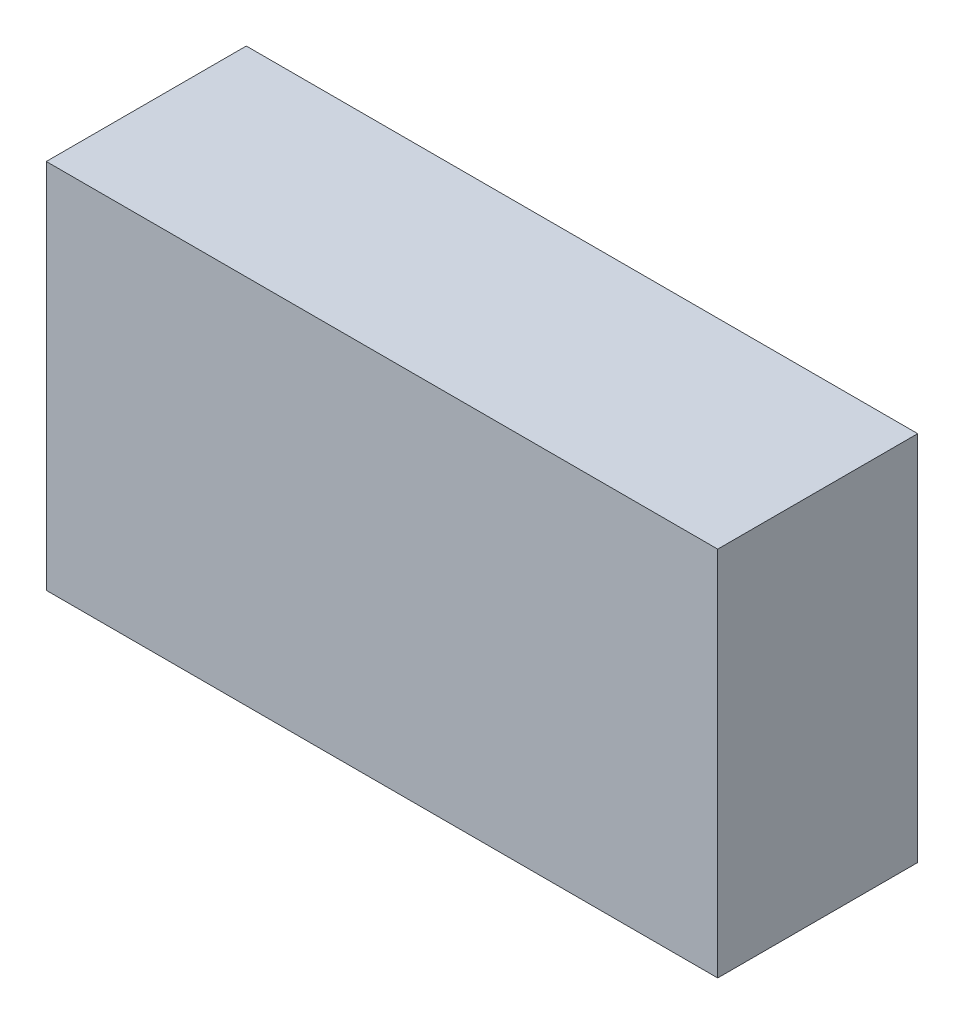
from build123d import *

# Parameters (mm, degrees)
SKETCH1_W           = 47
SKETCH1_H           = 26
BOSS_EXTRUDE1_DEPTH = 14
BOSS_EXTRUDE2_DEPTH = 0.5


with BuildPart() as part:
    # Sketch1 → Boss-Extrude1 (new body)
    with BuildSketch(Plane.XY):
        Rectangle(SKETCH1_W, SKETCH1_H)
    extrude(amount=BOSS_EXTRUDE1_DEPTH)

    # Sketch2 → Boss-Extrude2 (add)
    # profile 1 of 10: a face of its own
    with BuildSketch(Plane(origin=(0, 0, 0), x_dir=(-1, 0, 0), z_dir=(0, 0, -1))):
        Polygon((0.325641026, 3.175), (2.279487179, 3.175), (0.610576923, -0.081410256), (0.364438101, 0.054061498), (1.797385817, 2.849358974), (0.325641026, 2.849358974), align=None)
    # profile 2 of 10: a face of its own
    with BuildSketch(Plane(origin=(0, 0, 0), x_dir=(-1, 0, 0), z_dir=(0, 0, -1))):
        with BuildLine():
            add(Edge.make_bspline(
                [(3.073237179, 0.488461538), (3.090917586, 0.487410916), (3.125577957, 0.485351293), (3.175687737, 0.471221025), (3.221040036, 0.446130668), (3.261437144, 0.412690862), (3.294735162, 0.372145511), (3.320719681, 0.327154936), (3.33472686, 0.276625635), (3.33677148, 0.241764429), (3.337820513, 0.223878205)],
                knots=[0, 0, 0, 0, 1.020151414, 1.999887582, 2.974338812, 3.990962822, 5.007586832, 5.987933904, 6.967670073, 8, 8, 8, 8], degree=3))
            add(Edge.make_bspline(
                [(3.337820513, 0.223878205), (3.336735932, 0.206421756), (3.334597155, 0.171997895), (3.320751789, 0.121849711), (3.294537129, 0.076831019), (3.261666814, 0.035735508), (3.221030049, 0.002224861), (3.175580517, -0.02265203), (3.12569559, -0.037794041), (3.090937211, -0.039722896), (3.073237179, -0.040705128)],
                knots=[0, 0, 0, 0, 1.009421747, 1.99056486, 2.972319754, 3.999869655, 5.017953583, 5.993804169, 6.978383603, 8, 8, 8, 8], degree=3))
            add(Edge.make_bspline(
                [(3.073237179, -0.040705128), (3.055524394, -0.039758436), (3.020944396, -0.037910246), (2.971245673, -0.022341129), (2.925519351, 0.001991581), (2.884890498, 0.035797992), (2.851744885, 0.076619551), (2.826684716, 0.122159752), (2.811635081, 0.171854341), (2.809655811, 0.206393482), (2.808653846, 0.223878205)],
                knots=[0, 0, 0, 0, 1.022052826, 1.995314843, 2.982371812, 4.00089066, 5.028879526, 6.005146991, 6.990147033, 8, 8, 8, 8], degree=3))
            add(Edge.make_bspline(
                [(2.808653846, 0.223878205), (2.809617322, 0.241793714), (2.81149839, 0.276771546), (2.82671631, 0.326845022), (2.851550446, 0.372354963), (2.885119625, 0.412629004), (2.925509522, 0.4463632), (2.971135366, 0.470914834), (3.021064091, 0.485465779), (3.055544536, 0.487445633), (3.073237179, 0.488461538)],
                knots=[0, 0, 0, 0, 1.032775665, 2.016367738, 2.991239715, 4.008302682, 5.025365648, 6.011011707, 6.979408107, 8, 8, 8, 8], degree=3))
        make_face()
    # profile 3 of 10: a face of its own
    with BuildSketch(Plane(origin=(0, 0, 0), x_dir=(-1, 0, 0), z_dir=(0, 0, -1))):
        Polygon((5.478019832, 3.256410256), (5.535897436, 3.256410256), (5.535897436, 1.058333333), (5.90224359, 1.058333333), (5.90224359, 0.732692308), (5.535897436, 0.732692308), (5.535897436, 0), (5.250961538, 0), (5.250961538, 0.732692308), (3.744871795, 0.732692308), align=None)
        Polygon((5.250961538, 1.058333333), (5.250961538, 2.437219551), (4.304567308, 1.058333333), align=None, mode=Mode.SUBTRACT)
    # profile 4 of 10: a face of its own
    with BuildSketch(Plane(origin=(0, 0, 0), x_dir=(-1, 0, 0), z_dir=(0, 0, -1))):
        Polygon((6.227884615, 3.175), (6.533173077, 3.175), (7.59150641, 0.672906651), (8.649839744, 3.175), (8.955128205, 3.175), (7.611858974, 0), (7.571153846, 0), align=None)
    # profile 5 of 10: a face of its own
    with BuildSketch(Plane(origin=(0, 0, 0), x_dir=(-1, 0, 0), z_dir=(0, 0, -1))):
        Polygon((1.855263421, -3.03525641), (1.913141026, -3.03525641), (1.913141026, -5.233333333), (2.279487179, -5.233333333), (2.279487179, -5.558974359), (1.913141026, -5.558974359), (1.913141026, -6.291666667), (1.628205128, -6.291666667), (1.628205128, -5.558974359), (0.122115385, -5.558974359), align=None)
        Polygon((1.628205128, -5.233333333), (1.628205128, -3.854447115), (0.681810897, -5.233333333), align=None, mode=Mode.SUBTRACT)
    # profile 6 of 10: a face of its own
    with BuildSketch(Plane(origin=(0, 0, 0), x_dir=(-1, 0, 0), z_dir=(0, 0, -1))):
        with BuildLine():
            Line((4.558974359, -3.116666667), (4.558974359, -3.442307692))
            Line((4.558974359, -3.442307692), (3.479016426, -3.442307692))
            Line((3.479016426, -3.442307692), (3.307927684, -4.277398838))
            add(Edge.make_bspline(
                [(3.307927684, -4.277398838), (3.341542656, -4.26811852), (3.406666347, -4.250139372), (3.502787078, -4.230176994), (3.594038577, -4.218143342), (3.653252663, -4.216500224), (3.68190605, -4.215705128)],
                knots=[0, 0, 0, 0, 1.100273476, 2.13160584, 3.095893838, 4, 4, 4, 4], degree=3))
            add(Edge.make_bspline(
                [(3.68190605, -4.215705128), (3.717360585, -4.216472513), (3.78707306, -4.217981382), (3.889071247, -4.232470132), (3.986437515, -4.255275626), (4.078968236, -4.287134956), (4.166834593, -4.3278745), (4.249228167, -4.37876516), (4.327385702, -4.438213253), (4.399905055, -4.506561943), (4.465694963, -4.581783695), (4.523539825, -4.662662621), (4.572673032, -4.748412714), (4.61218886, -4.839853266), (4.64374322, -4.935973356), (4.664745387, -5.037784341), (4.678730544, -5.144326564), (4.680292995, -5.217174282), (4.681089744, -5.254321915)],
                knots=[0, 0, 0, 0, 1.052922333, 2.070308379, 3.05430497, 4.020497103, 4.973039431, 5.925935799, 6.892292201, 7.88610001, 8.88166317, 9.857072816, 10.836096531, 11.812156883, 12.81219415, 13.836441305, 14.89672472, 16, 16, 16, 16], degree=3))
            add(Edge.make_bspline(
                [(4.681089744, -5.254321915), (4.680486425, -5.280195644), (4.679287942, -5.331593439), (4.673193223, -5.40792425), (4.661458681, -5.482639106), (4.645703674, -5.555747918), (4.625254481, -5.627112277), (4.60049941, -5.696936449), (4.570204442, -5.764785842), (4.536974552, -5.831302451), (4.499558104, -5.894982525), (4.458030458, -5.954535534), (4.414156048, -6.010854847), (4.366947077, -6.063336448), (4.315964746, -6.111635471), (4.26182649, -6.156038555), (4.204964309, -6.197296619), (4.144498482, -6.23373491), (4.081776373, -6.267265592), (4.015892204, -6.294773372), (3.948345712, -6.319366494), (3.878164718, -6.338969423), (3.805508188, -6.354329668), (3.730256356, -6.364762356), (3.652803891, -6.372360982), (3.600302986, -6.372836648), (3.573783053, -6.373076923)],
                knots=[0, 0, 0, 0, 1.056347294, 2.098418968, 3.122841568, 4.141288669, 5.149314143, 6.15115421, 7.162517403, 8.180376062, 9.185164535, 10.17417709, 11.141909838, 12.097768115, 13.052685741, 14.0056014, 14.954263652, 15.917497458, 16.885230207, 17.854509472, 18.828990115, 19.81800267, 20.826176721, 21.857883937, 22.917946725, 24, 24, 24, 24], degree=3))
            add(Edge.make_bspline(
                [(3.573783053, -6.373076923), (3.542147189, -6.372450234), (3.479907364, -6.371217298), (3.38872085, -6.358319101), (3.300986886, -6.33984612), (3.217411723, -6.312054646), (3.137246362, -6.277231886), (3.061570039, -6.233220788), (2.988449085, -6.183346886), (2.920856024, -6.124491138), (2.858121549, -6.060160483), (2.801963502, -5.990348909), (2.751949471, -5.916208629), (2.708880372, -5.837379589), (2.672142882, -5.754068922), (2.643282142, -5.665964485), (2.619988206, -5.573526625), (2.610133532, -5.509887369), (2.605128205, -5.477564103)],
                knots=[0, 0, 0, 0, 1.0467383, 2.05933395, 3.04377827, 4.011590433, 4.970194871, 5.932262533, 6.905835911, 7.896367577, 8.894135286, 9.877477877, 10.858688626, 11.851381753, 12.8477658, 13.868841284, 14.917554742, 16, 16, 16, 16], degree=3))
            Line((2.605128205, -5.477564103), (2.890064103, -5.477564103))
            add(Edge.make_bspline(
                [(2.890064103, -5.477564103), (2.897075008, -5.507841313), (2.910550358, -5.566035793), (2.94012843, -5.647797795), (2.976292474, -5.720658805), (3.01929499, -5.785582641), (3.070593947, -5.842196518), (3.129131357, -5.892649138), (3.194761078, -5.938165148), (3.267689221, -5.976104373), (3.344626801, -6.008461028), (3.425151341, -6.030007208), (3.507070284, -6.045157304), (3.562477091, -6.04667383), (3.590319511, -6.047435897)],
                knots=[0, 0, 0, 0, 1.136247022, 2.183929868, 3.172523383, 4.106158343, 5.02341133, 5.958108904, 6.928429099, 7.938127109, 8.96079061, 9.975095812, 10.982467395, 12, 12, 12, 12], degree=3))
            add(Edge.make_bspline(
                [(3.590319511, -6.047435897), (3.6174961, -6.046691335), (3.671007026, -6.045225284), (3.749757355, -6.033941323), (3.825787605, -6.016562669), (3.898347565, -5.990555015), (3.968706961, -5.958945878), (4.035086025, -5.918382916), (4.099405063, -5.871701328), (4.15966487, -5.818219242), (4.214854942, -5.759282448), (4.263619423, -5.696256527), (4.30423848, -5.629021959), (4.338468708, -5.558742741), (4.364461343, -5.484648622), (4.383004233, -5.407086841), (4.393892722, -5.325865824), (4.395390578, -5.270467235), (4.396153846, -5.24223758)],
                knots=[0, 0, 0, 0, 1.027316725, 2.022795036, 3.002884548, 3.971462791, 4.93288096, 5.914575861, 6.907176829, 7.935150275, 8.956128384, 9.956726525, 10.942570165, 11.921478529, 12.907843606, 13.90538589, 14.932640048, 16, 16, 16, 16], degree=3))
            add(Edge.make_bspline(
                [(4.396153846, -5.24223758), (4.395556511, -5.216768863), (4.394387313, -5.166917472), (4.384834581, -5.093983906), (4.368218471, -5.024974789), (4.34515538, -4.959556877), (4.315873255, -4.897668468), (4.280089814, -4.839245692), (4.237133518, -4.785058572), (4.188064447, -4.735081756), (4.134308939, -4.688958191), (4.074942115, -4.649638912), (4.011206324, -4.61656093), (3.943869473, -4.58801496), (3.871329887, -4.567512855), (3.795024085, -4.552120559), (3.714128071, -4.543216623), (3.658818947, -4.541981196), (3.630388622, -4.541346154)],
                knots=[0, 0, 0, 0, 1.045622112, 2.046656509, 3.013763289, 3.955457236, 4.890082067, 5.820317437, 6.762574623, 7.722996705, 8.69280354, 9.665887285, 10.63943826, 11.638615906, 12.663482002, 13.728887084, 14.832589034, 16, 16, 16, 16], degree=3))
            add(Edge.make_bspline(
                [(3.630388622, -4.541346154), (3.605778808, -4.541872833), (3.554965785, -4.542960292), (3.477021507, -4.550967185), (3.395114015, -4.56388426), (3.309557294, -4.581651784), (3.220094405, -4.604902832), (3.126914141, -4.632765272), (3.029820585, -4.666077371), (2.964399507, -4.691234451), (2.930769231, -4.704166667)],
                knots=[0, 0, 0, 0, 0.817624296, 1.688186739, 2.600797293, 3.572016777, 4.590301741, 5.671205678, 6.80286297, 8, 8, 8, 8], degree=3))
            Line((2.930769231, -4.704166667), (3.256410256, -3.116666667))
            Line((3.256410256, -3.116666667), (4.558974359, -3.116666667))
        make_face()
    # profile 7 of 10: a face of its own
    with BuildSketch(Plane(origin=(0, 0, 0), x_dir=(-1, 0, 0), z_dir=(0, 0, -1))):
        with BuildLine():
            add(Edge.make_bspline(
                [(5.006730769, -4.705438702), (5.007028329, -4.654550357), (5.007606342, -4.555699014), (5.014036552, -4.411658661), (5.02471847, -4.276530398), (5.039357372, -4.15030776), (5.057171826, -4.032958159), (5.080953017, -3.924795201), (5.107997488, -3.825318272), (5.139341493, -3.734202985), (5.174708987, -3.650221783), (5.213202924, -3.571821779), (5.256350987, -3.499121598), (5.301687187, -3.430960888), (5.351046709, -3.368455393), (5.403024897, -3.310722407), (5.459650456, -3.259096226), (5.518998471, -3.212064223), (5.581606264, -3.170835059), (5.645689254, -3.134519647), (5.711688528, -3.103495481), (5.77978428, -3.079102014), (5.849364458, -3.058953603), (5.920672297, -3.045175058), (5.993825534, -3.036505577), (6.043202621, -3.03567675), (6.068244191, -3.03525641)],
                knots=[0, 0, 0, 0, 1.646270934, 3.197905019, 4.663502075, 6.030701355, 7.308322542, 8.50163776, 9.611534131, 10.641858119, 11.616356847, 12.558055219, 13.465016945, 14.349605745, 15.204443733, 16.039544428, 16.859896111, 17.680448484, 18.487036065, 19.28249412, 20.06191084, 20.843045899, 21.620316918, 22.403196591, 23.190181807, 24, 24, 24, 24], degree=3))
            add(Edge.make_bspline(
                [(6.068244191, -3.03525641), (6.093494946, -3.035698928), (6.143710754, -3.036578957), (6.217951666, -3.045037105), (6.290477449, -3.059071624), (6.360978903, -3.07895708), (6.430035141, -3.103627444), (6.497106025, -3.134549328), (6.562608163, -3.170543729), (6.625500638, -3.212838247), (6.686473897, -3.259993597), (6.744030263, -3.313299732), (6.798174977, -3.372218406), (6.849587575, -3.43611924), (6.896809438, -3.506227853), (6.941779623, -3.581324867), (6.982031399, -3.66272358), (7.020797854, -3.749065861), (7.054259621, -3.842740752), (7.084436857, -3.943220213), (7.108819922, -4.051691083), (7.12913019, -4.167584248), (7.144864489, -4.291325322), (7.1563241, -4.422649051), (7.162377541, -4.561641834), (7.163517549, -4.656672169), (7.164102564, -4.705438702)],
                knots=[0, 0, 0, 0, 0.810914788, 1.612654377, 2.396697861, 3.181598691, 3.963628158, 4.749916497, 5.551656086, 6.361998678, 7.18212741, 8.025565596, 8.878627764, 9.750805457, 10.657531673, 11.591944965, 12.560506719, 13.57287815, 14.630710178, 15.753379473, 16.941251878, 18.199788006, 19.531962791, 20.947069417, 22.433333509, 24, 24, 24, 24], degree=3))
            add(Edge.make_bspline(
                [(7.164102564, -4.705438702), (7.163511484, -4.753992533), (7.162359788, -4.848597692), (7.156391961, -4.986965077), (7.144636631, -5.117591873), (7.129931856, -5.240791364), (7.109565626, -5.356050775), (7.084523796, -5.463768954), (7.056719575, -5.564411076), (7.022398012, -5.657152655), (6.984832582, -5.743287432), (6.943961082, -5.823721202), (6.900173454, -5.899164911), (6.85246795, -5.969014681), (6.801619496, -6.03376532), (6.746539788, -6.092273878), (6.688781472, -6.14595013), (6.62762878, -6.193712678), (6.563755444, -6.235518179), (6.498478282, -6.272905029), (6.43063907, -6.303051831), (6.361775177, -6.32893719), (6.290901587, -6.348713314), (6.218106647, -6.362387454), (6.143760633, -6.371977631), (6.093503499, -6.372709224), (6.068244191, -6.373076923)],
                knots=[0, 0, 0, 0, 1.561518951, 3.042555995, 4.452378317, 5.7783523, 7.031515105, 8.214008947, 9.334062868, 10.386615937, 11.391082383, 12.354592575, 13.286541444, 14.194233754, 15.072674879, 15.931287219, 16.775624067, 17.606195743, 18.42308326, 19.229000347, 20.022332153, 20.807536673, 21.593273796, 22.3848459, 23.188221202, 24, 24, 24, 24], degree=3))
            add(Edge.make_bspline(
                [(6.068244191, -6.373076923), (6.043203316, -6.372653872), (5.993827598, -6.371819698), (5.920664327, -6.363189384), (5.849650967, -6.349314178), (5.780437098, -6.329886259), (5.712667616, -6.306105657), (5.647265985, -6.275123387), (5.583505014, -6.239441767), (5.521554817, -6.198805921), (5.4625795, -6.152249822), (5.406247193, -6.100756503), (5.353973069, -6.04304098), (5.305319282, -5.980014579), (5.259078502, -5.912257137), (5.216543142, -5.838843542), (5.177199582, -5.760064888), (5.141237272, -5.675412212), (5.109352413, -5.583650242), (5.081187707, -5.483729201), (5.058949864, -5.37476716), (5.039915326, -5.257639262), (5.024562492, -5.131842197), (5.014081069, -4.99730767), (5.007602876, -4.854119516), (5.007026776, -4.755903363), (5.006730769, -4.705438702)],
                knots=[0, 0, 0, 0, 0.810891512, 1.598919785, 2.382837074, 3.152667961, 3.926044502, 4.706494248, 5.493654104, 6.291793342, 7.103789334, 7.925228297, 8.761435821, 9.622817696, 10.50288917, 11.416980706, 12.369136599, 13.353924996, 14.394355917, 15.514179734, 16.714354668, 17.994756427, 19.357759367, 20.818452758, 22.365282078, 24, 24, 24, 24], degree=3))
        make_face()
        with BuildLine():
            add(Edge.make_bspline(
                [(5.291666667, -4.704166667), (5.291775022, -4.746574415), (5.291985319, -4.828879527), (5.297479158, -4.948480199), (5.304963297, -5.060031855), (5.314616474, -5.163676134), (5.328952006, -5.259062217), (5.345014592, -5.346846144), (5.364561787, -5.426563352), (5.387689411, -5.498760866), (5.41403202, -5.564663949), (5.442793768, -5.625987909), (5.473691709, -5.683457165), (5.508271225, -5.73655551), (5.545931318, -5.785456102), (5.585821346, -5.831024457), (5.629430047, -5.871661719), (5.689758442, -5.920399651), (5.769402387, -5.970763437), (5.869750942, -6.014620247), (5.972864466, -6.042181475), (6.042851671, -6.045686454), (6.077784455, -6.047435897)],
                knots=[0, 0, 0, 0, 1.459021318, 2.831673884, 4.118529203, 5.306027144, 6.411944654, 7.436330062, 8.375795394, 9.233974572, 10.042671642, 10.816086306, 11.563610507, 12.285937304, 12.993564865, 13.685989202, 14.367179055, 15.041617293, 16.353048772, 17.594441528, 18.799311195, 20, 20, 20, 20], degree=3))
            add(Edge.make_bspline(
                [(6.077784455, -6.047435897), (6.1129432, -6.045986482), (6.1831881, -6.043090644), (6.285816615, -6.015151789), (6.38544836, -5.972997278), (6.463527905, -5.923152041), (6.522929927, -5.875682771), (6.56549034, -5.835210911), (6.604553769, -5.789893803), (6.641603366, -5.740999442), (6.675584099, -5.687593688), (6.706484231, -5.629933352), (6.734681267, -5.567858312), (6.750745902, -5.524524335), (6.758959335, -5.50236879)],
                knots=[0, 0, 0, 0, 1.353760809, 2.704726607, 4.075137775, 5.516104923, 6.260822281, 7.007110065, 7.778089737, 8.566572457, 9.372053459, 10.217411131, 11.088608312, 12, 12, 12, 12], degree=3))
            add(Edge.make_bspline(
                [(6.758959335, -5.50236879), (6.768531296, -5.474038955), (6.787966481, -5.41651724), (6.813014305, -5.327287356), (6.832740488, -5.233667706), (6.850487256, -5.136217778), (6.862600385, -5.034218907), (6.872350187, -4.927986687), (6.878093025, -4.817441023), (6.878804906, -4.742334138), (6.879166667, -4.704166667)],
                knots=[0, 0, 0, 0, 0.884706709, 1.796334032, 2.740027952, 3.714592787, 4.726048262, 5.777819803, 6.87074269, 8, 8, 8, 8], degree=3))
            add(Edge.make_bspline(
                [(6.879166667, -4.704166667), (6.878667566, -4.666005369), (6.87769122, -4.591353712), (6.873959245, -4.482026505), (6.864322145, -4.378187894), (6.853618659, -4.279390536), (6.837836894, -4.186181333), (6.820820884, -4.097779985), (6.797959784, -4.015281669), (6.773539702, -3.937394763), (6.745590272, -3.865004169), (6.714823856, -3.797772378), (6.681965546, -3.735374806), (6.646276514, -3.677982652), (6.60818043, -3.625338845), (6.566671796, -3.578498891), (6.523397115, -3.53601107), (6.462784382, -3.487512882), (6.383432705, -3.438062987), (6.284694153, -3.392555477), (6.181941498, -3.36642224), (6.112478436, -3.362737709), (6.077784455, -3.360897436)],
                knots=[0, 0, 0, 0, 1.31362396, 2.569729283, 3.763502607, 4.902122613, 5.988968491, 7.01645872, 7.998833611, 8.933434873, 9.825090667, 10.667526885, 11.477055099, 12.250526234, 12.991942729, 13.710640831, 14.402115721, 15.076753259, 16.378508321, 17.609869233, 18.806226677, 20, 20, 20, 20], degree=3))
            add(Edge.make_bspline(
                [(6.077784455, -3.360897436), (6.042668418, -3.362740248), (5.972372371, -3.36642923), (5.868551726, -3.39245811), (5.769034207, -3.437827015), (5.689892366, -3.487676667), (5.62923736, -3.535154992), (5.586526631, -3.57632699), (5.546479746, -3.621363235), (5.509588332, -3.670713544), (5.475035911, -3.723749984), (5.443303135, -3.780889792), (5.414712415, -3.842422529), (5.388328585, -3.90829601), (5.365130413, -3.980487295), (5.345995175, -4.060106311), (5.328317634, -4.147611027), (5.315803355, -4.243513724), (5.304678376, -4.347183963), (5.297528868, -4.459014101), (5.291966941, -4.578815361), (5.291768763, -4.661546026), (5.291666667, -4.704166667)],
                knots=[0, 0, 0, 0, 1.207732386, 2.417664972, 3.655092373, 4.956220595, 5.625982001, 6.301752483, 6.994047911, 7.697131622, 8.419323945, 9.170223765, 9.943494443, 10.752040957, 11.610060368, 12.549350801, 13.567764191, 14.679664412, 15.874934091, 17.154273443, 18.533957287, 20, 20, 20, 20], degree=3))
        make_face(mode=Mode.SUBTRACT)
    # profile 8 of 10: a face of its own
    with BuildSketch(Plane(origin=(0, 0, 0), x_dir=(-1, 0, 0), z_dir=(0, 0, -1))):
        with BuildLine():
            Line((7.652564103, -3.971474359), (7.9375, -3.971474359))
            Line((7.9375, -3.971474359), (7.9375, -4.374709535))
            add(Edge.make_bspline(
                [(7.9375, -4.374709535), (7.963157583, -4.339432925), (8.012319972, -4.271839558), (8.092933814, -4.182766943), (8.17346643, -4.107176403), (8.231463141, -4.067495369), (8.25932492, -4.048432492)],
                knots=[0, 0, 0, 0, 1.134379233, 2.173579362, 3.122582517, 4, 4, 4, 4], degree=3))
            add(Edge.make_bspline(
                [(8.25932492, -4.048432492), (8.297302149, -4.030284768), (8.372593101, -3.994306381), (8.491809112, -3.957808796), (8.613796848, -3.935379597), (8.696172871, -3.932312208), (8.737610176, -3.930769231)],
                knots=[0, 0, 0, 0, 1.014936303, 2.012140481, 3.000054389, 4, 4, 4, 4], degree=3))
            add(Edge.make_bspline(
                [(8.737610176, -3.930769231), (8.765634537, -3.931717459), (8.821093241, -3.933593951), (8.903265952, -3.945804126), (8.982966264, -3.966909869), (9.059723276, -3.996307941), (9.132041321, -4.031910293), (9.198343665, -4.073683956), (9.257874196, -4.120580589), (9.310602828, -4.174717907), (9.358018302, -4.237616107), (9.401632684, -4.310971533), (9.441932698, -4.39643134), (9.464267742, -4.458449559), (9.476026643, -4.491100761)],
                knots=[0, 0, 0, 0, 1.009824226, 1.998387844, 2.986035974, 3.974953746, 4.955485308, 5.885931332, 6.793869504, 7.679848016, 8.601185859, 9.625726857, 10.749998409, 12, 12, 12, 12], degree=3))
            add(Edge.make_bspline(
                [(9.476026643, -4.491100761), (9.488464706, -4.468672181), (9.512941069, -4.424535885), (9.554039754, -4.362071604), (9.597099827, -4.303645443), (9.64248826, -4.249211043), (9.690044849, -4.199037216), (9.739993405, -4.152958077), (9.7920496, -4.11077574), (9.86443256, -4.061496874), (9.958605425, -4.00915366), (10.077339644, -3.963770714), (10.200847299, -3.935725369), (10.284683354, -3.932432193), (10.327018229, -3.930769231)],
                knots=[0, 0, 0, 0, 0.86119277, 1.694706429, 2.50939023, 3.298075842, 4.073795165, 4.829715201, 5.57930267, 6.321991688, 7.768977793, 9.186738141, 10.579381044, 12, 12, 12, 12], degree=3))
            add(Edge.make_bspline(
                [(10.327018229, -3.930769231), (10.365917842, -3.932236281), (10.442048161, -3.935107441), (10.552880395, -3.957653092), (10.65624189, -3.996367815), (10.751924666, -4.049194042), (10.838248211, -4.115578016), (10.91328372, -4.19456189), (10.976575407, -4.285586983), (11.017921744, -4.371214002), (11.045966305, -4.446811054), (11.063257568, -4.511223904), (11.078533577, -4.582118527), (11.091216564, -4.659579692), (11.10048625, -4.74388103), (11.107353971, -4.834884582), (11.112002237, -4.932661076), (11.112330689, -5.000121208), (11.1125, -5.034895833)],
                knots=[0, 0, 0, 0, 1.209669288, 2.367440248, 3.500751976, 4.631527125, 5.755587489, 6.87532382, 8.007944318, 9.190864318, 9.82315674, 10.514484317, 11.263564316, 12.079023757, 12.955305781, 13.901327259, 14.918167583, 16, 16, 16, 16], degree=3))
            Line((11.1125, -5.034895833), (11.1125, -6.291666667))
            Line((11.1125, -6.291666667), (10.827564103, -6.291666667))
            Line((10.827564103, -6.291666667), (10.827564103, -5.033623798))
            add(Edge.make_bspline(
                [(10.827564103, -5.033623798), (10.827493452, -5.003941563), (10.827357671, -4.946896822), (10.824914162, -4.865024955), (10.820310128, -4.790395803), (10.814926562, -4.723111123), (10.80744825, -4.663014007), (10.797790869, -4.610225171), (10.787560402, -4.564329356), (10.770564181, -4.513451299), (10.743397165, -4.457326179), (10.702015594, -4.396798364), (10.649881998, -4.344110781), (10.589683856, -4.298374165), (10.521150624, -4.261187076), (10.445617625, -4.234629553), (10.363553807, -4.218189513), (10.306745992, -4.216551199), (10.277408854, -4.215705128)],
                knots=[0, 0, 0, 0, 1.253487763, 2.409012846, 3.458416907, 4.410876679, 5.259312806, 6.014470957, 6.676830364, 7.243083969, 8.276244668, 9.299465089, 10.325150304, 11.392391894, 12.482080715, 13.603491619, 14.762376348, 16, 16, 16, 16], degree=3))
            add(Edge.make_bspline(
                [(10.277408854, -4.215705128), (10.241422538, -4.216989785), (10.170299898, -4.219528756), (10.066481492, -4.245449341), (9.96672207, -4.284529282), (9.873998342, -4.34116444), (9.788701704, -4.409026313), (9.71531423, -4.489716303), (9.65468789, -4.581002023), (9.613636069, -4.665499388), (9.587701488, -4.741399527), (9.570577429, -4.807709286), (9.557257495, -4.883076137), (9.544765658, -4.966993646), (9.536612505, -5.060039453), (9.529202624, -5.161783145), (9.525736556, -5.272530737), (9.525251725, -5.349299233), (9.525, -5.389157652)],
                knots=[0, 0, 0, 0, 1.090531906, 2.155305635, 3.229839962, 4.33261226, 5.44038871, 6.529323825, 7.629011124, 8.757537029, 9.370236727, 10.061839251, 10.834451254, 11.692844982, 12.636905849, 13.66920014, 14.789842145, 16, 16, 16, 16], degree=3))
            Line((9.525, -5.389157652), (9.525, -6.291666667))
            Line((9.525, -6.291666667), (9.240064103, -6.291666667))
            Line((9.240064103, -6.291666667), (9.240064103, -5.111853966))
            add(Edge.make_bspline(
                [(9.240064103, -5.111853966), (9.239992047, -5.078567884), (9.23985342, -5.014528808), (9.237425618, -4.922695403), (9.232811326, -4.839164709), (9.227476828, -4.764033809), (9.219802238, -4.697439247), (9.211084811, -4.639024002), (9.20079, -4.588934521), (9.18374489, -4.533994879), (9.157696765, -4.47346947), (9.115797413, -4.408934401), (9.063539108, -4.352448341), (9.002242671, -4.304225762), (8.933294659, -4.264364561), (8.857109717, -4.235644643), (8.774373832, -4.218931181), (8.71733477, -4.216800759), (8.688000801, -4.215705128)],
                knots=[0, 0, 0, 0, 1.320475261, 2.540461679, 3.643808994, 4.639130445, 5.527981419, 6.302341397, 6.981980563, 7.553956391, 8.582137848, 9.585246428, 10.591171744, 11.620968678, 12.668337649, 13.738356861, 14.836885341, 16, 16, 16, 16], degree=3))
            add(Edge.make_bspline(
                [(8.688000801, -4.215705128), (8.653514667, -4.217093474), (8.584785025, -4.219860398), (8.483818238, -4.244765347), (8.386313368, -4.283776186), (8.293825891, -4.337896165), (8.208850057, -4.404933186), (8.134456843, -4.483777413), (8.071916123, -4.573447607), (8.030430834, -4.65705399), (8.003671504, -4.731052604), (7.985895736, -4.793963821), (7.97061979, -4.863814046), (7.959267784, -4.940818782), (7.948309122, -5.024476489), (7.943020198, -5.115203919), (7.937875281, -5.212923242), (7.937628162, -5.280389765), (7.9375, -5.315379607)],
                knots=[0, 0, 0, 0, 1.098833095, 2.189935336, 3.297829714, 4.440610912, 5.596351641, 6.740013378, 7.886572111, 9.072425424, 9.705826452, 10.395263256, 11.156850408, 11.985370555, 12.878090359, 13.847760091, 14.883794034, 16, 16, 16, 16], degree=3))
            Line((7.9375, -5.315379607), (7.9375, -6.291666667))
            Line((7.9375, -6.291666667), (7.652564103, -6.291666667))
            Line((7.652564103, -6.291666667), (7.652564103, -3.971474359))
        make_face()
    # profile 9 of 10: a face of its own
    with BuildSketch(Plane(origin=(0, 0, 0), x_dir=(-1, 0, 0), z_dir=(0, 0, -1))):
        Polygon((13.14775641, -3.116666667), (14.613141026, -6.291666667), (14.303400441, -6.291666667), (13.834019431, -5.274038462), (12.394711538, -5.274038462), (11.911974159, -6.291666667), (11.600961538, -6.291666667), (13.107051282, -3.116666667), align=None)
        Polygon((13.124223758, -3.735511819), (12.549263822, -4.948397436), (13.683919271, -4.948397436), align=None, mode=Mode.SUBTRACT)
    # profile 10 of 10: a face of its own
    with BuildSketch(Plane(origin=(0, 0, 0), x_dir=(-1, 0, 0), z_dir=(0, 0, -1))):
        with BuildLine():
            Line((15.101602564, -3.03525641), (15.386538462, -3.03525641))
            Line((15.386538462, -3.03525641), (15.386538462, -4.409690505))
            add(Edge.make_bspline(
                [(15.386538462, -4.409690505), (15.417124871, -4.371459892), (15.476678177, -4.297022931), (15.57691394, -4.199903137), (15.679848231, -4.11572153), (15.789036309, -4.048710473), (15.902474995, -3.995772751), (16.02064273, -3.958228243), (16.143561468, -3.935140463), (16.227041425, -3.932239041), (16.269330929, -3.930769231)],
                knots=[0, 0, 0, 0, 1.125788106, 2.19196713, 3.20547328, 4.180437432, 5.132270164, 6.079753143, 7.027236121, 8, 8, 8, 8], degree=3))
            add(Edge.make_bspline(
                [(16.269330929, -3.930769231), (16.312266357, -3.932352585), (16.396301346, -3.935451592), (16.518658101, -3.959956588), (16.632922609, -4.001827978), (16.738755195, -4.059129494), (16.833846171, -4.130496987), (16.918074171, -4.212894154), (16.98687261, -4.308392637), (17.03368038, -4.396617953), (17.064136257, -4.475120965), (17.0834147, -4.542464087), (17.099760687, -4.61750468), (17.11400259, -4.700204116), (17.123494553, -4.790959378), (17.131118743, -4.889361023), (17.13654024, -4.995403409), (17.136750339, -5.068809635), (17.136858974, -5.106765825)],
                knots=[0, 0, 0, 0, 1.235656852, 2.418478516, 3.575258207, 4.727955599, 5.870717718, 6.98870536, 8.107142894, 9.245821548, 9.854588956, 10.528768408, 11.260415777, 12.065282286, 12.943670737, 13.886611085, 14.907229059, 16, 16, 16, 16], degree=3))
            Line((17.136858974, -5.106765825), (17.136858974, -6.291666667))
            Line((17.136858974, -6.291666667), (16.851923077, -6.291666667))
            Line((16.851923077, -6.291666667), (16.851923077, -5.200260417))
            add(Edge.make_bspline(
                [(16.851923077, -5.200260417), (16.851750445, -5.168671281), (16.851420229, -5.10824664), (16.850328623, -5.021735956), (16.847891842, -4.943271605), (16.843954093, -4.873105056), (16.839812707, -4.811138487), (16.834112841, -4.757461888), (16.827481414, -4.712001535), (16.821522591, -4.684637907), (16.81885016, -4.672365785)],
                knots=[0, 0, 0, 0, 1.430932559, 2.737130458, 3.918967929, 4.986496826, 5.920444988, 6.731744033, 7.431208747, 8, 8, 8, 8], degree=3))
            add(Edge.make_bspline(
                [(16.81885016, -4.672365785), (16.808486738, -4.636357418), (16.788563119, -4.56713154), (16.742255311, -4.473094925), (16.684416779, -4.392917339), (16.613798192, -4.327680806), (16.531648819, -4.276507481), (16.437432994, -4.241067422), (16.332037447, -4.219071274), (16.257786469, -4.216858477), (16.219085537, -4.215705128)],
                knots=[0, 0, 0, 0, 1.090059168, 2.095632401, 3.037101401, 3.955032261, 4.878929692, 5.839099886, 6.873700383, 8, 8, 8, 8], degree=3))
            add(Edge.make_bspline(
                [(16.219085537, -4.215705128), (16.196164057, -4.216136771), (16.15080304, -4.21699098), (16.083539608, -4.225567016), (16.018289672, -4.239581211), (15.954424839, -4.258544614), (15.893298652, -4.284348779), (15.833129386, -4.314221165), (15.775621782, -4.350786511), (15.719754648, -4.391812743), (15.667759457, -4.437233168), (15.619384146, -4.485172906), (15.57626008, -4.536222337), (15.537190715, -4.589562443), (15.503464699, -4.645924855), (15.474025117, -4.704766058), (15.449046307, -4.766163433), (15.43663415, -4.808776525), (15.430423678, -4.830098157)],
                knots=[0, 0, 0, 0, 1.024319606, 2.027102035, 3.025350316, 4.005802111, 5.00026367, 5.987881639, 7.005602596, 8.042517216, 9.083927026, 10.089214625, 11.084353441, 12.06828073, 13.041928858, 14.016821737, 15.00770877, 16, 16, 16, 16], degree=3))
            add(Edge.make_bspline(
                [(15.430423678, -4.830098157), (15.426850055, -4.845538591), (15.41906269, -4.879185197), (15.410612805, -4.934679048), (15.403049233, -4.999164543), (15.396655191, -5.072543873), (15.392733534, -5.155085929), (15.388507844, -5.246227442), (15.386934846, -5.346539318), (15.386674538, -5.416294528), (15.386538462, -5.452759415)],
                knots=[0, 0, 0, 0, 0.607992626, 1.324890765, 2.152360218, 3.099583803, 4.150613268, 5.323148443, 6.60066238, 8, 8, 8, 8], degree=3))
            Line((15.386538462, -5.452759415), (15.386538462, -6.291666667))
            Line((15.386538462, -6.291666667), (15.101602564, -6.291666667))
            Line((15.101602564, -6.291666667), (15.101602564, -3.03525641))
        make_face()
    extrude(amount=BOSS_EXTRUDE2_DEPTH)


solid = part.part
